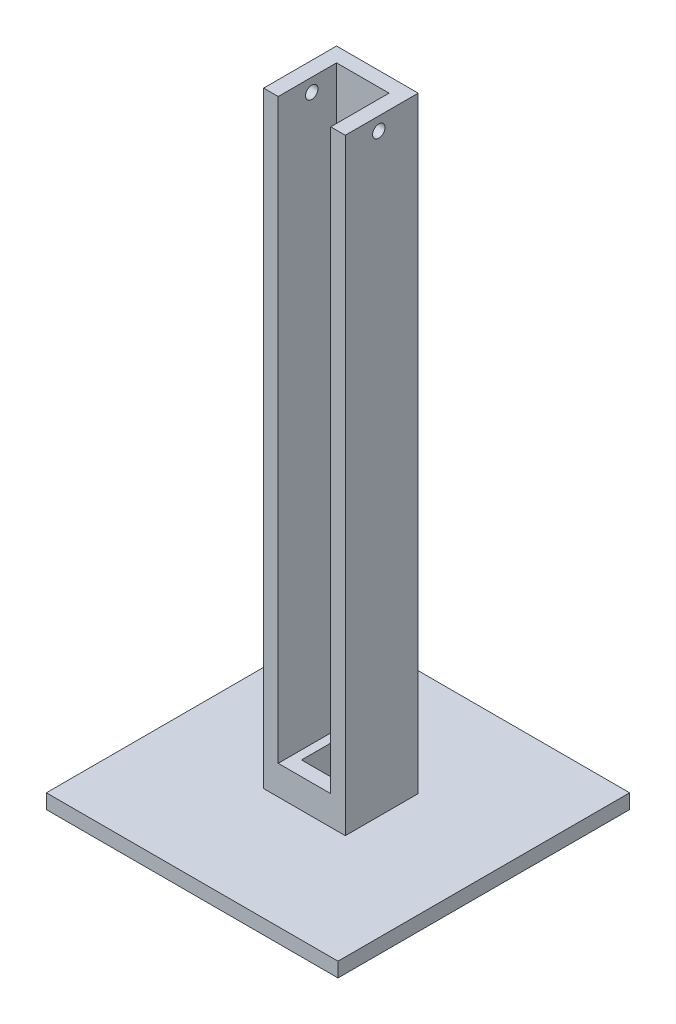
from build123d import *

# Parameters (mm, degrees)
BOSS_EXTRUDE2_DEPTH = 208
CUT_EXTRUDE1_REACH  = 212.31
SKETCH5_R           = 2.125
SKETCH6_W           = 100
SKETCH6_H           = 100
BOSS_EXTRUDE5_DEPTH = 5
CUT_EXTRUDE2_REACH  = 221.691
SKETCH7_R           = 4.5
SKETCH8_W           = 18
SKETCH8_H           = 23
SKETCH8_W_2         = 12
SKETCH8_H_2         = 15.5
BOSS_EXTRUDE6_DEPTH = 10
CUT_EXTRUDE7_START  = -5
SKETCH10_R          = 4.8
SKETCH10_R_2        = 4.5
CUT_EXTRUDE7_DEPTH  = 5


with BuildPart() as part:
    # Sketch3 → Boss-Extrude2 (new body)
    with BuildSketch(Plane(origin=(0, 0, 0), x_dir=(1, 0, 0), z_dir=(0, 1, 0))):
        Polygon((9, 8.5), (-9, 8.5), (-9, -11.5), (-14, -11.5), (-14, 13.5), (14, 13.5), (14, -11.5), (9, -11.5), align=None)
    extrude(amount=-BOSS_EXTRUDE2_DEPTH)

    # Cut-Extrude1: up to this face of the body (flat: up to its plane)
    cut_extrude1_end = Plane(part.part.faces().sort_by_distance((-14, -104, -1))[0])
    # Sketch5 → Cut-Extrude1 (cut, up to the picked face)
    with BuildSketch(Plane(origin=(14, 0, 0), x_dir=(0, 0, -1), z_dir=(1, 0, 0)), mode=Mode.PRIVATE) as cut_extrude1_sk1:
        with Locations((0, -4.5)):
            Circle(SKETCH5_R)
    cut_extrude1_tool1 = split(extrude(cut_extrude1_sk1.sketch, amount=-CUT_EXTRUDE1_REACH, mode=Mode.PRIVATE), bisect_by=cut_extrude1_end, keep=Keep.BOTH, mode=Mode.PRIVATE)
    add(cut_extrude1_tool1.solids().sort_by(Axis((14, -4.5, 0), (-1, 0, 0)))[0], mode=Mode.SUBTRACT)

    # Sketch6 → Boss-Extrude5 (add)
    with BuildSketch(Plane.XZ.offset(208)):
        Rectangle(SKETCH6_W, SKETCH6_H)
    extrude(amount=BOSS_EXTRUDE5_DEPTH)

    # Sketch7 → Cut-Extrude2 (cut, up to next)
    with BuildSketch(Plane(origin=(0, -208, 0), x_dir=(1, 0, 0), z_dir=(0, 1, 0)), mode=Mode.PRIVATE) as cut_extrude2_sk1:
        with Locations(Location((0, 0, 0), (0, 0, 270))):
            Circle(SKETCH7_R)
    cut_extrude2_tool1 = extrude(cut_extrude2_sk1.sketch, amount=-CUT_EXTRUDE2_REACH, mode=Mode.PRIVATE) & part.part
    add(cut_extrude2_tool1.solids().sort_by_distance((0, -208, 0))[0], mode=Mode.SUBTRACT)

    # Sketch8 → Boss-Extrude6 (add)
    with BuildSketch(Plane(origin=(0, -208, 0), x_dir=(1, 0, 0), z_dir=(0, 1, 0))):
        Rectangle(SKETCH8_W, SKETCH8_H)
        with Locations((0, 1.25)):
            Rectangle(SKETCH8_W_2, SKETCH8_H_2, mode=Mode.SUBTRACT)
    extrude(amount=BOSS_EXTRUDE6_DEPTH)

    # Sketch10 → Cut-Extrude7 (cut)
    with BuildSketch(Plane.XZ.offset(213).offset(CUT_EXTRUDE7_START)):
        with Locations(Location((0, 0, 0), (0, 0, 270))):
            Circle(SKETCH10_R)
        Circle(SKETCH10_R_2, mode=Mode.SUBTRACT)
    extrude(amount=CUT_EXTRUDE7_DEPTH, mode=Mode.SUBTRACT)


solid = part.part
